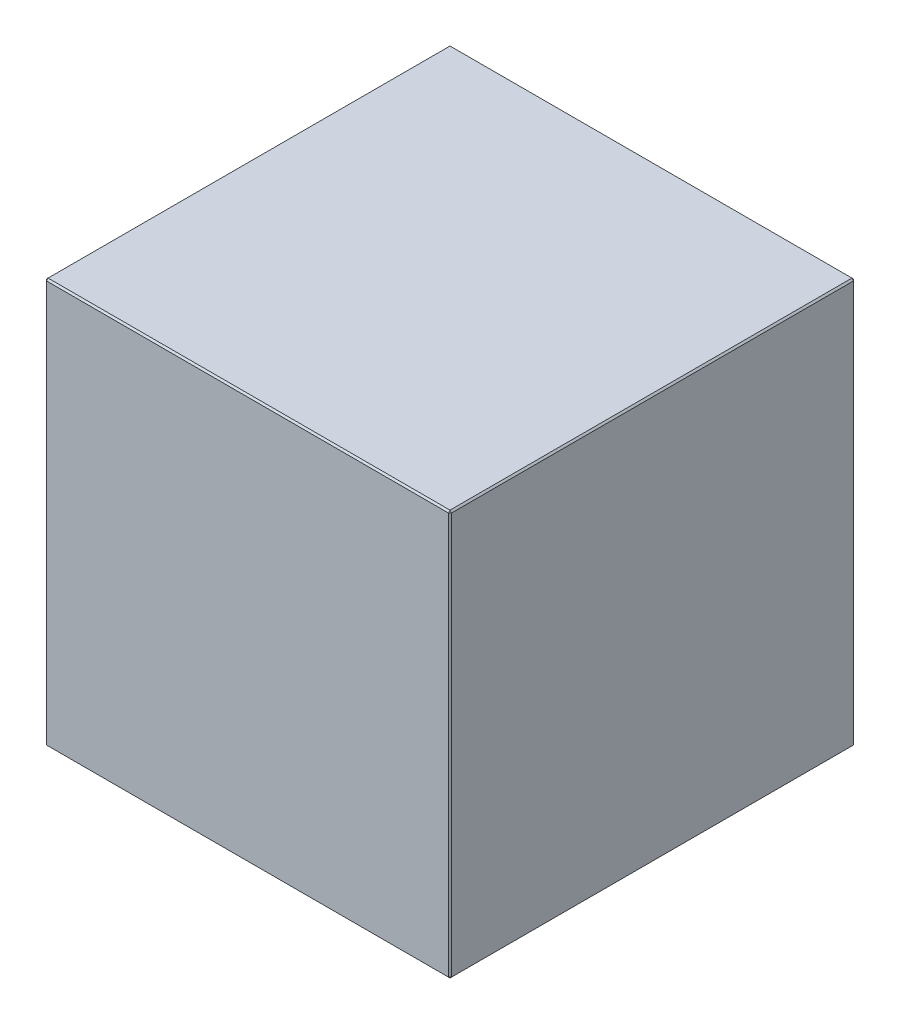
from build123d import *

# Parameters (mm, degrees)
SKETCH_1_W      = 250
SKETCH_1_H      = 250
EXTRUDE_1_DEPTH = 250
CHAMFER_1_SIZE  = 1


with BuildPart() as part:
    # 草图1 → 凸台-拉伸1 (new body)
    with BuildSketch(Plane(origin=(0, 0, 0), x_dir=(1, 0, 0), z_dir=(0, 1, 0))):
        Rectangle(SKETCH_1_W, SKETCH_1_H)
    extrude(amount=EXTRUDE_1_DEPTH)

    # 倒角1
    chamfer_1_edges = [part.edges().sort_by_distance(p)[0] for p in [
        (-125, 250, 0),
        (0, 250, 125),
        (125, 250, 0),
        (0, 0, 125),
        (-125, 0, 0),
        (0, 0, -125),
        (125, 0, 0),
        (125, 125, 125),
        (-125, 125, 125),
        (-125, 125, -125),
        (125, 125, -125),
        (0, 250, -125),
    ]]
    chamfer(chamfer_1_edges, length=CHAMFER_1_SIZE)


solid = part.part
